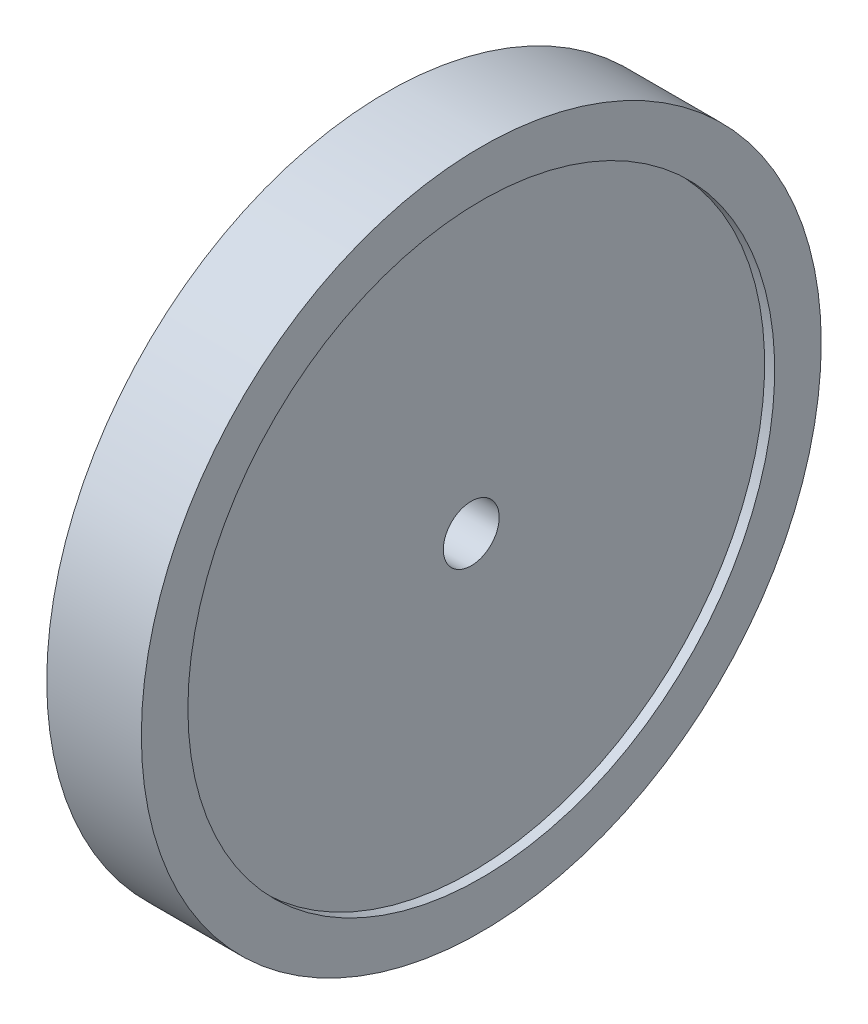
from build123d import *

# Parameters (mm, degrees)
ESQUISSE2_R             = 3
ENL_V_MAT_EXTRU_2_DEPTH = 53.428729839


with BuildPart() as part:
    # Esquisse1 → Révolution1 (revolve)
    with BuildSketch(Plane.XY, mode=Mode.PRIVATE) as r_volution1_sk:
        Polygon((-4, 31.5125), (-5.08, 31.5125), (-5.08, 36.5125), (5.08, 36.5125), (5.08, 31.5125), (4, 31.5125), (4, 0), (-4, 0), align=None)
    revolve(r_volution1_sk.sketch.rotate(Axis((-4, 0, 0), (1, 0, 0)), 90), axis=Axis((-4, 0, 0), (1, 0, 0)))

    # Esquisse2 → Enlèv. mat.-Extru.2 (cut, through all)
    with BuildSketch(Plane(origin=(4, 0, 0), x_dir=(0, 0, -1), z_dir=(1, 0, 0))):
        Circle(ESQUISSE2_R)
    extrude(amount=-ENL_V_MAT_EXTRU_2_DEPTH, mode=Mode.SUBTRACT)


solid = part.part
